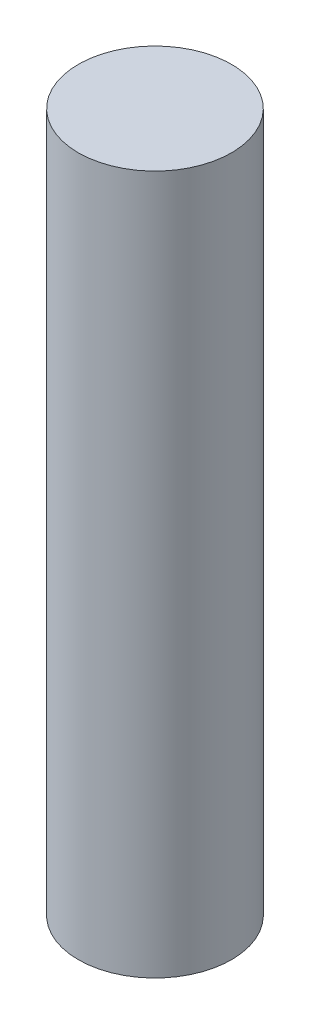
from build123d import *

# Parameters (mm, degrees)
SKETCH2_R           = 50.8
BOSS_EXTRUDE1_DEPTH = 463.296


with BuildPart() as part:
    # Sketch2 → Boss-Extrude1 (new body)
    with BuildSketch(Plane(origin=(0, 0, 0), x_dir=(1, 0, 0), z_dir=(0, 1, 0))):
        with Locations(Location((0, 0, 0), (0, 0, 270))):
            Circle(SKETCH2_R)
    extrude(amount=BOSS_EXTRUDE1_DEPTH)


solid = part.part
